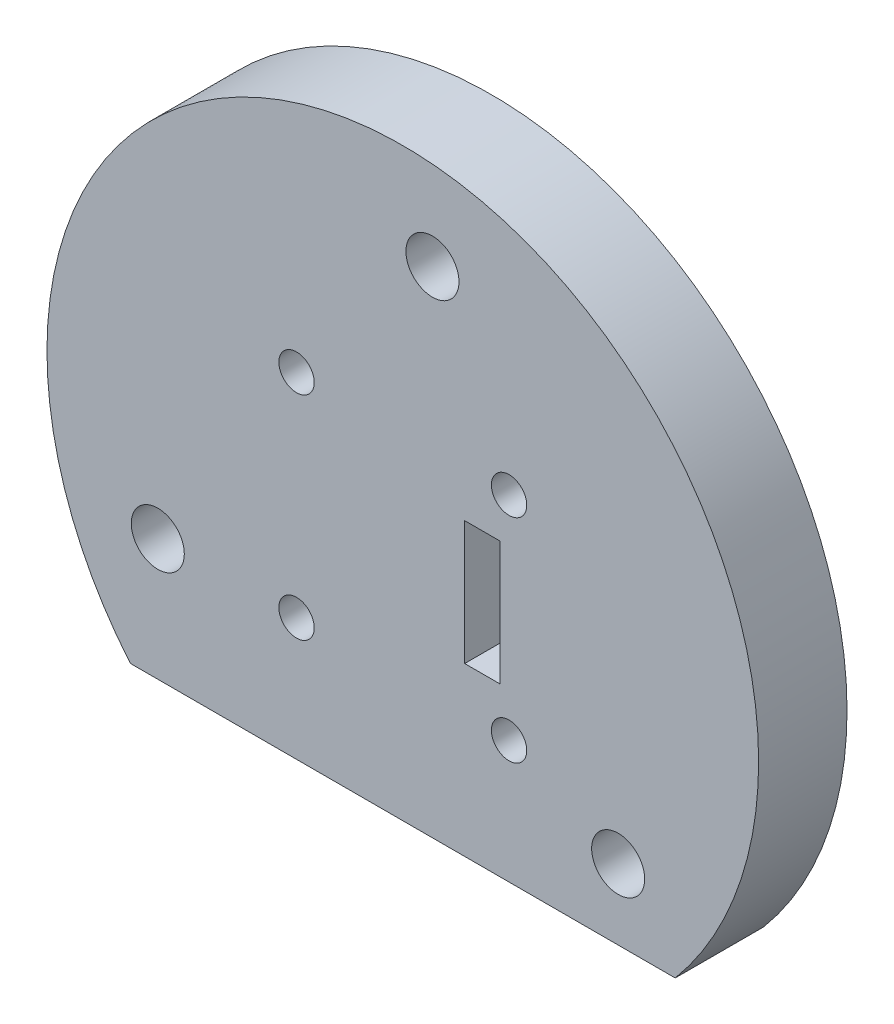
from build123d import *

# Parameters (mm, degrees)
SKETCH1_R           = 1.5
SKETCH1_R_2         = 1
SKETCH1_W           = 2
SKETCH1_H           = 7
BOSS_EXTRUDE1_DEPTH = 5


with BuildPart() as part:
    # Sketch1 → Boss-Extrude1 (new body)
    with BuildSketch(Plane.XY):
        with BuildLine():
            Line((10.74521866, -60), (-20.072092256, -60))
            ThreePointArc((-20.072092256, -60), (-4.663436798, -26.922179377), (10.74521866, -60))
        make_face()
        with Locations((7.518690065, -56.019210774)):
            Circle(SKETCH1_R, mode=Mode.SUBTRACT)
        with Locations((-18.522064611, -53.115425948)):
            Circle(SKETCH1_R, mode=Mode.SUBTRACT)
        with Locations((-2.986935847, -32.015363278)):
            Circle(SKETCH1_R, mode=Mode.SUBTRACT)
        with Locations((1.346970842, -41.03959236)):
            Circle(SKETCH1_R_2, mode=Mode.SUBTRACT)
        with Locations((1.346970842, -53.06040764)):
            Circle(SKETCH1_R_2, mode=Mode.SUBTRACT)
        with Locations((-10.673844438, -53.06040764)):
            Circle(SKETCH1_R_2, mode=Mode.SUBTRACT)
        with Locations((-10.673844438, -41.03959236)):
            Circle(SKETCH1_R_2, mode=Mode.SUBTRACT)
        with Locations((-0.163436798, -47.05)):
            Rectangle(SKETCH1_W, SKETCH1_H, mode=Mode.SUBTRACT)
    extrude(amount=BOSS_EXTRUDE1_DEPTH)


solid = part.part
